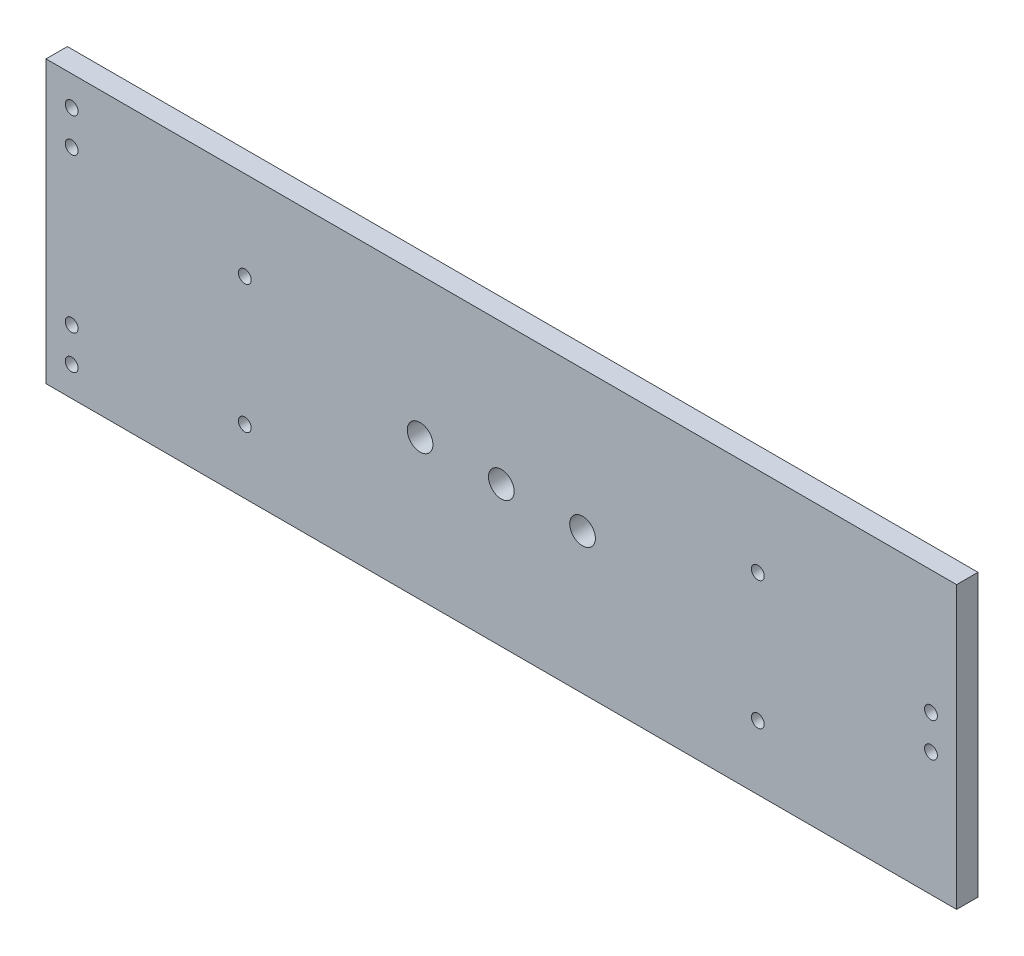
from build123d import *

# Parameters (mm, degrees)
SKETCH_3_W          = 213
SKETCH_3_H          = 65.8
SKETCH_3_R          = 3
EXTRUDE_2_DEPTH     = 5
SKETCH_4_R          = 1.5
CUT_EXTRUDE_1_DEPTH = 5
SKETCH_5_R          = 1.5
CUT_EXTRUDE_2_DEPTH = 5
SKETCH_6_R          = 3
CUT_EXTRUDE_3_DEPTH = 10


with BuildPart() as part:
    # 草图3 → 凸台-拉伸2 (new body)
    with BuildSketch(Plane.XY):
        Rectangle(SKETCH_3_W, SKETCH_3_H)
        Circle(SKETCH_3_R, mode=Mode.SUBTRACT)
    extrude(amount=EXTRUDE_2_DEPTH)

    # 草图4 → 切除-拉伸1 (cut)
    with BuildSketch(Plane.XY.offset(5)):
        with Locations((60, 12.1)):
            Circle(SKETCH_4_R)
        with Locations((60, -17.9)):
            Circle(SKETCH_4_R)
        with Locations((-60, -17.9)):
            Circle(SKETCH_4_R)
        with Locations((-60, 12.1)):
            Circle(SKETCH_4_R)
    extrude(amount=-CUT_EXTRUDE_1_DEPTH, mode=Mode.SUBTRACT)

    # 草图5 → 切除-拉伸2 (cut)
    with BuildSketch(Plane.XY.offset(5)):
        with Locations((-100.5, 26)):
            Circle(SKETCH_5_R)
        with Locations((-100.5, 18)):
            Circle(SKETCH_5_R)
        with Locations((-100.5, -18)):
            Circle(SKETCH_5_R)
        with Locations((-100.5, -26)):
            Circle(SKETCH_5_R)
        with Locations((100.5, -4)):
            Circle(SKETCH_5_R)
        with Locations((100.5, 4)):
            Circle(SKETCH_5_R)
    extrude(amount=-CUT_EXTRUDE_2_DEPTH, mode=Mode.SUBTRACT)

    # 草图6 → 切除-拉伸3 (cut)
    with BuildSketch(Plane.XY.offset(5)):
        with Locations((19, 0)):
            Circle(SKETCH_6_R)
        with Locations((-19, 0)):
            Circle(SKETCH_6_R)
    extrude(amount=-CUT_EXTRUDE_3_DEPTH, mode=Mode.SUBTRACT)


solid = part.part
